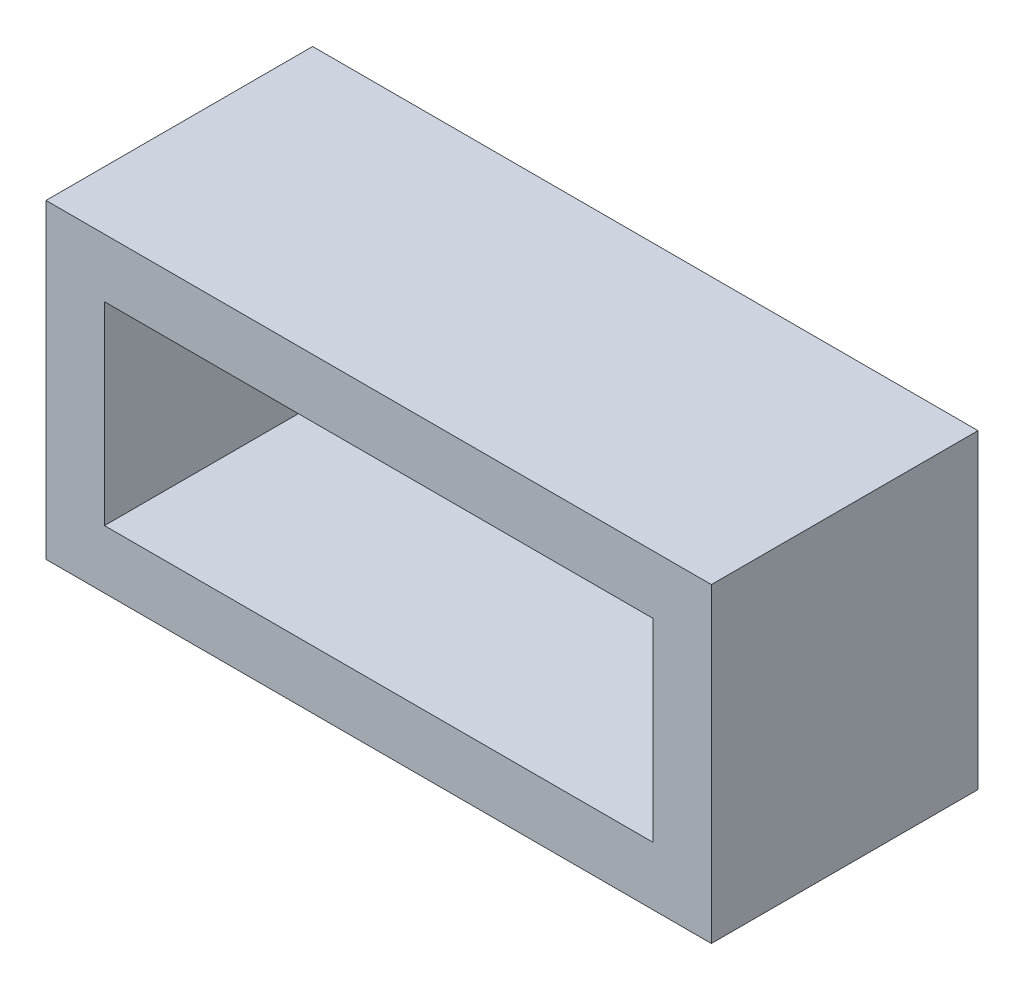
from build123d import *

# Parameters (mm, degrees)
SKETCH_1_W      = 21.96
SKETCH_1_H      = 10.26
SKETCH_1_W_2    = 18.1
SKETCH_1_H_2    = 6.4
EXTRUDE_1_DEPTH = 8.8


with BuildPart() as part:
    # 스케치1 → 보스-돌출1 (new body)
    with BuildSketch(Plane.XY):
        with Locations((0.130632814, -0.806487114)):
            Rectangle(SKETCH_1_W, SKETCH_1_H)
        with Locations((0.130632814, -0.806487114)):
            Rectangle(SKETCH_1_W_2, SKETCH_1_H_2, mode=Mode.SUBTRACT)
    extrude(amount=EXTRUDE_1_DEPTH)


solid = part.part
